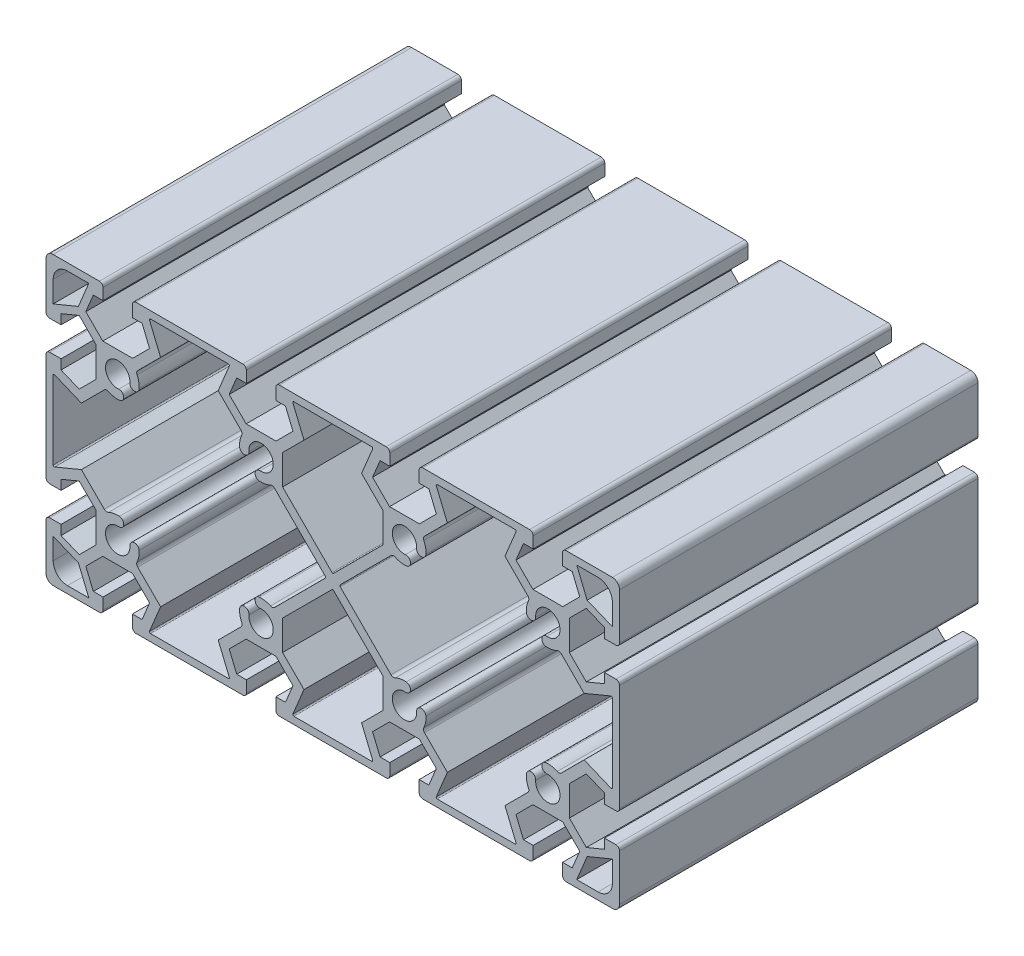
from build123d import *

# Parameters (mm, degrees)
EXTRUDE_1_DEPTH = 100


with BuildPart() as part:
    # 草图1 → 凸台-拉伸1 (new body)
    with BuildSketch(Plane.XY):
        with BuildLine():
            Line((-38.968782805, 40.151402525), (-53.868782805, 40.151402525))
            ThreePointArc((-53.868782805, 40.151402525), (-54.575889586, 39.858509306), (-54.868782805, 39.151402525))
            Line((-54.868782805, 39.151402525), (-54.868782805, 35.951402525))
            Line((-54.868782805, 35.951402525), (-52.168782805, 35.951402525))
            Line((-52.168782805, 35.951402525), (-50.071221467, 30.887441494))
            Line((-50.071221467, 30.887441494), (-54.807260436, 26.151402525))
            Line((-54.807260436, 26.151402525), (-63.130305174, 26.151402525))
            Line((-63.130305174, 26.151402525), (-67.866344143, 30.887441494))
            Line((-67.866344143, 30.887441494), (-65.768782805, 35.951402525))
            Line((-65.768782805, 35.951402525), (-63.068782805, 35.951402525))
            Line((-63.068782805, 35.951402525), (-63.068782805, 39.151402525))
            ThreePointArc((-63.068782805, 39.151402525), (-63.361676024, 39.858509306), (-64.068782805, 40.151402525))
            Line((-64.068782805, 40.151402525), (-76.968782805, 40.151402525))
            ThreePointArc((-76.968782805, 40.151402525), (-78.382996367, 39.565616087), (-78.968782805, 38.151402525))
            Line((-78.968782805, 38.151402525), (-78.968782805, 25.251402525))
            ThreePointArc((-78.968782805, 25.251402525), (-78.675889586, 24.544295743), (-77.968782805, 24.251402525))
            Line((-77.968782805, 24.251402525), (-74.768782805, 24.251402525))
            Line((-74.768782805, 24.251402525), (-74.768782805, 26.951402525))
            Line((-74.768782805, 26.951402525), (-69.704821774, 29.048963863))
            Line((-69.704821774, 29.048963863), (-64.968782805, 24.312924893))
            Line((-64.968782805, 24.312924893), (-64.968782805, 15.989880156))
            Line((-64.968782805, 15.989880156), (-69.704821774, 11.253841186))
            Line((-69.704821774, 11.253841186), (-74.768782805, 13.351402525))
            Line((-74.768782805, 13.351402525), (-74.768782805, 16.051402525))
            Line((-74.768782805, 16.051402525), (-77.968782805, 16.051402525))
            ThreePointArc((-77.968782805, 16.051402525), (-78.675889586, 15.758509306), (-78.968782805, 15.051402525))
            Line((-78.968782805, 15.051402525), (-78.968782805, 0.151402525))
            Line((-78.968782805, 0.151402525), (-78.968782805, -14.748597475))
            ThreePointArc((-78.968782805, -14.748597475), (-78.675889586, -15.455704257), (-77.968782805, -15.748597475))
            Line((-77.968782805, -15.748597475), (-74.768782805, -15.748597475))
            Line((-74.768782805, -15.748597475), (-74.768782805, -13.048597475))
            Line((-74.768782805, -13.048597475), (-69.704821774, -10.951036137))
            Line((-69.704821774, -10.951036137), (-64.968782805, -15.687075107))
            Line((-64.968782805, -15.687075107), (-64.968782805, -24.010119844))
            Line((-64.968782805, -24.010119844), (-69.704821774, -28.746158814))
            Line((-69.704821774, -28.746158814), (-74.768782805, -26.648597475))
            Line((-74.768782805, -26.648597475), (-74.768782805, -23.948597475))
            Line((-74.768782805, -23.948597475), (-77.968782805, -23.948597475))
            ThreePointArc((-77.968782805, -23.948597475), (-78.675889586, -24.241490694), (-78.968782805, -24.948597475))
            Line((-78.968782805, -24.948597475), (-78.968782805, -37.848597475))
            ThreePointArc((-78.968782805, -37.848597475), (-78.382996367, -39.262811038), (-76.968782805, -39.848597475))
            Line((-76.968782805, -39.848597475), (-64.068782805, -39.848597475))
            ThreePointArc((-64.068782805, -39.848597475), (-63.361676024, -39.555704257), (-63.068782805, -38.848597475))
            Line((-63.068782805, -38.848597475), (-63.068782805, -35.648597475))
            Line((-63.068782805, -35.648597475), (-65.768782805, -35.648597475))
            Line((-65.768782805, -35.648597475), (-67.866344143, -30.584636445))
            Line((-67.866344143, -30.584636445), (-63.130305174, -25.848597475))
            Line((-63.130305174, -25.848597475), (-54.807260436, -25.848597475))
            Line((-54.807260436, -25.848597475), (-50.071221467, -30.584636445))
            Line((-50.071221467, -30.584636445), (-52.168782805, -35.648597475))
            Line((-52.168782805, -35.648597475), (-54.868782805, -35.648597475))
            Line((-54.868782805, -35.648597475), (-54.868782805, -38.848597475))
            ThreePointArc((-54.868782805, -38.848597475), (-54.575889586, -39.555704257), (-53.868782805, -39.848597475))
            Line((-53.868782805, -39.848597475), (-38.968782805, -39.848597475))
            Line((-38.968782805, -39.848597475), (-24.068782805, -39.848597475))
            ThreePointArc((-24.068782805, -39.848597475), (-23.361676024, -39.555704257), (-23.068782805, -38.848597475))
            Line((-23.068782805, -38.848597475), (-23.068782805, -35.648597475))
            Line((-23.068782805, -35.648597475), (-25.768782805, -35.648597475))
            Line((-25.768782805, -35.648597475), (-27.866344143, -30.584636445))
            Line((-27.866344143, -30.584636445), (-23.130305174, -25.848597475))
            Line((-23.130305174, -25.848597475), (-14.807260436, -25.848597475))
            Line((-14.807260436, -25.848597475), (-10.071221467, -30.584636445))
            Line((-10.071221467, -30.584636445), (-12.168782805, -35.648597475))
            Line((-12.168782805, -35.648597475), (-14.868782805, -35.648597475))
            Line((-14.868782805, -35.648597475), (-14.868782805, -38.848597475))
            ThreePointArc((-14.868782805, -38.848597475), (-14.575889586, -39.555704257), (-13.868782805, -39.848597475))
            Line((-13.868782805, -39.848597475), (1.031217195, -39.848597475))
            Line((1.031217195, -39.848597475), (15.931217195, -39.848597475))
            ThreePointArc((15.931217195, -39.848597475), (16.638323976, -39.555704257), (16.931217195, -38.848597475))
            Line((16.931217195, -38.848597475), (16.931217195, -35.648597475))
            Line((16.931217195, -35.648597475), (14.231217195, -35.648597475))
            Line((14.231217195, -35.648597475), (12.133655857, -30.584636445))
            Line((12.133655857, -30.584636445), (16.869694826, -25.848597475))
            Line((16.869694826, -25.848597475), (25.192739564, -25.848597475))
            Line((25.192739564, -25.848597475), (29.928778533, -30.584636445))
            Line((29.928778533, -30.584636445), (27.831217195, -35.648597475))
            Line((27.831217195, -35.648597475), (25.131217195, -35.648597475))
            Line((25.131217195, -35.648597475), (25.131217195, -38.848597475))
            ThreePointArc((25.131217195, -38.848597475), (25.424110414, -39.555704257), (26.131217195, -39.848597475))
            Line((26.131217195, -39.848597475), (41.031217195, -39.848597475))
            Line((41.031217195, -39.848597475), (55.931217195, -39.848597475))
            ThreePointArc((55.931217195, -39.848597475), (56.638323976, -39.555704257), (56.931217195, -38.848597475))
            Line((56.931217195, -38.848597475), (56.931217195, -35.648597475))
            Line((56.931217195, -35.648597475), (54.231217195, -35.648597475))
            Line((54.231217195, -35.648597475), (52.133655857, -30.584636445))
            Line((52.133655857, -30.584636445), (56.869694826, -25.848597475))
            Line((56.869694826, -25.848597475), (65.192739564, -25.848597475))
            Line((65.192739564, -25.848597475), (69.928778533, -30.584636445))
            Line((69.928778533, -30.584636445), (67.831217195, -35.648597475))
            Line((67.831217195, -35.648597475), (65.131217195, -35.648597475))
            Line((65.131217195, -35.648597475), (65.131217195, -38.848597475))
            ThreePointArc((65.131217195, -38.848597475), (65.424110414, -39.555704257), (66.131217195, -39.848597475))
            Line((66.131217195, -39.848597475), (79.031217195, -39.848597475))
            ThreePointArc((79.031217195, -39.848597475), (80.445430757, -39.262811038), (81.031217195, -37.848597475))
            Line((81.031217195, -37.848597475), (81.031217195, -24.948597475))
            ThreePointArc((81.031217195, -24.948597475), (80.738323976, -24.241490694), (80.031217195, -23.948597475))
            Line((80.031217195, -23.948597475), (76.831217195, -23.948597475))
            Line((76.831217195, -23.948597475), (76.831217195, -26.648597475))
            Line((76.831217195, -26.648597475), (71.767256164, -28.746158814))
            Line((71.767256164, -28.746158814), (67.031217195, -24.010119844))
            Line((67.031217195, -24.010119844), (67.031217195, -15.687075107))
            Line((67.031217195, -15.687075107), (71.767256164, -10.951036137))
            Line((71.767256164, -10.951036137), (76.831217195, -13.048597475))
            Line((76.831217195, -13.048597475), (76.831217195, -15.748597475))
            Line((76.831217195, -15.748597475), (80.031217195, -15.748597475))
            ThreePointArc((80.031217195, -15.748597475), (80.738323976, -15.455704257), (81.031217195, -14.748597475))
            Line((81.031217195, -14.748597475), (81.031217195, 0.151402525))
            Line((81.031217195, 0.151402525), (81.031217195, 15.051402525))
            ThreePointArc((81.031217195, 15.051402525), (80.738323976, 15.758509306), (80.031217195, 16.051402525))
            Line((80.031217195, 16.051402525), (76.831217195, 16.051402525))
            Line((76.831217195, 16.051402525), (76.831217195, 13.351402525))
            Line((76.831217195, 13.351402525), (71.767256164, 11.253841186))
            Line((71.767256164, 11.253841186), (67.031217195, 15.989880156))
            Line((67.031217195, 15.989880156), (67.031217195, 24.312924893))
            Line((67.031217195, 24.312924893), (71.767256164, 29.048963863))
            Line((71.767256164, 29.048963863), (76.831217195, 26.951402525))
            Line((76.831217195, 26.951402525), (76.831217195, 24.251402525))
            Line((76.831217195, 24.251402525), (80.031217195, 24.251402525))
            ThreePointArc((80.031217195, 24.251402525), (80.738323976, 24.544295743), (81.031217195, 25.251402525))
            Line((81.031217195, 25.251402525), (81.031217195, 38.151402525))
            ThreePointArc((81.031217195, 38.151402525), (80.445430757, 39.565616087), (79.031217195, 40.151402525))
            Line((79.031217195, 40.151402525), (66.131217195, 40.151402525))
            ThreePointArc((66.131217195, 40.151402525), (65.424110414, 39.858509306), (65.131217195, 39.151402525))
            Line((65.131217195, 39.151402525), (65.131217195, 35.951402525))
            Line((65.131217195, 35.951402525), (67.831217195, 35.951402525))
            Line((67.831217195, 35.951402525), (69.928778533, 30.887441494))
            Line((69.928778533, 30.887441494), (65.192739564, 26.151402525))
            Line((65.192739564, 26.151402525), (56.869694826, 26.151402525))
            Line((56.869694826, 26.151402525), (52.133655857, 30.887441494))
            Line((52.133655857, 30.887441494), (54.231217195, 35.951402525))
            Line((54.231217195, 35.951402525), (56.931217195, 35.951402525))
            Line((56.931217195, 35.951402525), (56.931217195, 39.151402525))
            ThreePointArc((56.931217195, 39.151402525), (56.638323976, 39.858509306), (55.931217195, 40.151402525))
            Line((55.931217195, 40.151402525), (41.031217195, 40.151402525))
            Line((41.031217195, 40.151402525), (26.131217195, 40.151402525))
            ThreePointArc((26.131217195, 40.151402525), (25.424110414, 39.858509306), (25.131217195, 39.151402525))
            Line((25.131217195, 39.151402525), (25.131217195, 35.951402525))
            Line((25.131217195, 35.951402525), (27.831217195, 35.951402525))
            Line((27.831217195, 35.951402525), (29.928778533, 30.887441494))
            Line((29.928778533, 30.887441494), (25.192739564, 26.151402525))
            Line((25.192739564, 26.151402525), (16.869694826, 26.151402525))
            Line((16.869694826, 26.151402525), (12.133655857, 30.887441494))
            Line((12.133655857, 30.887441494), (14.231217195, 35.951402525))
            Line((14.231217195, 35.951402525), (16.931217195, 35.951402525))
            Line((16.931217195, 35.951402525), (16.931217195, 39.151402525))
            ThreePointArc((16.931217195, 39.151402525), (16.638323976, 39.858509306), (15.931217195, 40.151402525))
            Line((15.931217195, 40.151402525), (1.031217195, 40.151402525))
            Line((1.031217195, 40.151402525), (-13.868782805, 40.151402525))
            ThreePointArc((-13.868782805, 40.151402525), (-14.575889586, 39.858509306), (-14.868782805, 39.151402525))
            Line((-14.868782805, 39.151402525), (-14.868782805, 35.951402525))
            Line((-14.868782805, 35.951402525), (-12.168782805, 35.951402525))
            Line((-12.168782805, 35.951402525), (-10.071221467, 30.887441494))
            Line((-10.071221467, 30.887441494), (-14.807260436, 26.151402525))
            Line((-14.807260436, 26.151402525), (-23.130305174, 26.151402525))
            Line((-23.130305174, 26.151402525), (-27.866344143, 30.887441494))
            Line((-27.866344143, 30.887441494), (-25.768782805, 35.951402525))
            Line((-25.768782805, 35.951402525), (-23.068782805, 35.951402525))
            Line((-23.068782805, 35.951402525), (-23.068782805, 39.151402525))
            ThreePointArc((-23.068782805, 39.151402525), (-23.361676024, 39.858509306), (-24.068782805, 40.151402525))
            Line((-24.068782805, 40.151402525), (-38.968782805, 40.151402525))
        make_face()
        with BuildLine():
            Line((-67.022297368, 38.151402525), (-72.968782805, 38.151402525))
            ThreePointArc((-72.968782805, 38.151402525), (-75.79720993, 36.979829649), (-76.968782805, 34.151402525))
            Line((-76.968782805, 34.151402525), (-76.968782805, 28.204917088))
            Line((-76.968782805, 28.204917088), (-69.935555504, 31.118175223))
            Line((-69.935555504, 31.118175223), (-67.022297368, 38.151402525))
        make_face(mode=Mode.SUBTRACT)
        with BuildLine():
            Line((-76.968782805, 10.999470912), (-76.968782805, 0.151402525))
            Line((-76.968782805, 0.151402525), (-76.968782805, -10.696665863))
            ThreePointArc((-76.968782805, -10.696665863), (-76.835453875, -10.946106747), (-76.553977775, -10.973829723))
            Line((-76.553977775, -10.973829723), (-69.094775623, -7.884127027))
            Line((-69.094775623, -7.884127027), (-62.724477144, -14.254425505))
            ThreePointArc((-62.724477144, -14.254425505), (-62.183985002, -14.533340814), (-61.581857855, -14.447501403))
            ThreePointArc((-61.581857855, -14.447501403), (-60.069306273, -13.950390282), (-58.479261583, -13.86860007))
            ThreePointArc((-58.479261583, -13.86860007), (-57.28965841, -15.270329106), (-58.691387446, -16.459932279))
            ThreePointArc((-58.691387446, -16.459932279), (-61.372945861, -22.252760531), (-55.580117608, -19.571202116))
            ThreePointArc((-55.580117608, -19.571202116), (-54.390514435, -18.16947308), (-52.988785399, -19.359076253))
            ThreePointArc((-52.988785399, -19.359076253), (-53.070575612, -20.949120943), (-53.567686733, -22.461672525))
            ThreePointArc((-53.567686733, -22.461672525), (-53.653526144, -23.063799672), (-53.374610835, -23.604291815))
            Line((-53.374610835, -23.604291815), (-47.004312356, -29.974590293))
            Line((-47.004312356, -29.974590293), (-50.094015052, -37.433792446))
            ThreePointArc((-50.094015052, -37.433792446), (-50.066292076, -37.715268545), (-49.816851193, -37.848597475))
            Line((-49.816851193, -37.848597475), (-38.968782805, -37.848597475))
            Line((-38.968782805, -37.848597475), (-28.120714417, -37.848597475))
            ThreePointArc((-28.120714417, -37.848597475), (-27.871273534, -37.715268545), (-27.843550558, -37.433792446))
            Line((-27.843550558, -37.433792446), (-30.933253254, -29.974590293))
            Line((-30.933253254, -29.974590293), (-24.562954775, -23.604291815))
            ThreePointArc((-24.562954775, -23.604291815), (-24.284039466, -23.063799672), (-24.369878878, -22.461672525))
            ThreePointArc((-24.369878878, -22.461672525), (-24.866989999, -20.949120943), (-24.948780211, -19.359076253))
            ThreePointArc((-24.948780211, -19.359076253), (-23.547051175, -18.16947308), (-22.357448002, -19.571202116))
            ThreePointArc((-22.357448002, -19.571202116), (-16.564619749, -22.252760531), (-19.246178164, -16.459932279))
            ThreePointArc((-19.246178164, -16.459932279), (-20.647907201, -15.270329106), (-19.458304028, -13.86860007))
            ThreePointArc((-19.458304028, -13.86860007), (-17.868259338, -13.950390282), (-16.355707755, -14.447501403))
            ThreePointArc((-16.355707755, -14.447501403), (-15.753580609, -14.533340814), (-15.213088466, -14.254425505))
            Line((-15.213088466, -14.254425505), (-1.019392472, -0.060729511))
            ThreePointArc((-1.019392472, -0.060729511), (-0.931524505, 0.151402523), (-1.019392469, 0.363534558))
            Line((-1.019392469, 0.363534558), (-15.213088466, 14.557230554))
            ThreePointArc((-15.213088466, 14.557230554), (-15.753580609, 14.836145863), (-16.355707755, 14.750306452))
            ThreePointArc((-16.355707755, 14.750306452), (-17.868259338, 14.253195331), (-19.458304028, 14.171405119))
            ThreePointArc((-19.458304028, 14.171405119), (-20.647907201, 15.573134155), (-19.246178164, 16.762737328))
            ThreePointArc((-19.246178164, 16.762737328), (-16.564619749, 22.555565581), (-22.357448002, 19.874007165))
            ThreePointArc((-22.357448002, 19.874007165), (-23.547051175, 18.472278129), (-24.948780211, 19.661881302))
            ThreePointArc((-24.948780211, 19.661881302), (-24.866989999, 21.251925992), (-24.369878878, 22.764477574))
            ThreePointArc((-24.369878878, 22.764477574), (-24.284039466, 23.366604721), (-24.562954775, 23.907096864))
            Line((-24.562954775, 23.907096864), (-30.933253254, 30.277395342))
            Line((-30.933253254, 30.277395342), (-27.843550558, 37.736597495))
            ThreePointArc((-27.843550558, 37.736597495), (-27.871273534, 38.018073594), (-28.120714417, 38.151402525))
            Line((-28.120714417, 38.151402525), (-38.968782805, 38.151402525))
            Line((-38.968782805, 38.151402525), (-49.816851193, 38.151402525))
            ThreePointArc((-49.816851193, 38.151402525), (-50.066292076, 38.018073594), (-50.094015052, 37.736597495))
            Line((-50.094015052, 37.736597495), (-47.004312356, 30.277395342))
            Line((-47.004312356, 30.277395342), (-53.374610835, 23.907096864))
            ThreePointArc((-53.374610835, 23.907096864), (-53.653526144, 23.366604721), (-53.567686733, 22.764477574))
            ThreePointArc((-53.567686733, 22.764477574), (-53.070575612, 21.251925992), (-52.988785399, 19.661881302))
            ThreePointArc((-52.988785399, 19.661881302), (-54.390514435, 18.472278129), (-55.580117608, 19.874007165))
            ThreePointArc((-55.580117608, 19.874007165), (-61.372945861, 22.555565581), (-58.691387446, 16.762737328))
            ThreePointArc((-58.691387446, 16.762737328), (-57.28965841, 15.573134155), (-58.479261583, 14.171405119))
            ThreePointArc((-58.479261583, 14.171405119), (-60.069306273, 14.253195331), (-61.581857855, 14.750306452))
            ThreePointArc((-61.581857855, 14.750306452), (-62.183985002, 14.836145863), (-62.724477144, 14.557230554))
            Line((-62.724477144, 14.557230554), (-69.094775623, 8.186932076))
            Line((-69.094775623, 8.186932076), (-76.553977775, 11.276634772))
            ThreePointArc((-76.553977775, 11.276634772), (-76.835453875, 11.248911796), (-76.968782805, 10.999470912))
        make_face(mode=Mode.SUBTRACT)
        with BuildLine():
            Line((69.084731758, 38.151402525), (75.031217195, 38.151402525))
            ThreePointArc((75.031217195, 38.151402525), (77.85964432, 36.979829649), (79.031217195, 34.151402525))
            Line((79.031217195, 34.151402525), (79.031217195, 28.204917088))
            Line((79.031217195, 28.204917088), (71.997989894, 31.118175223))
            Line((71.997989894, 31.118175223), (69.084731758, 38.151402525))
        make_face(mode=Mode.SUBTRACT)
        with BuildLine():
            Line((79.031217195, 10.999470912), (79.031217195, 0.151402525))
            Line((79.031217195, 0.151402525), (79.031217195, -10.696665863))
            ThreePointArc((79.031217195, -10.696665863), (78.897888265, -10.946106747), (78.616412165, -10.973829723))
            Line((78.616412165, -10.973829723), (71.157210013, -7.884127027))
            Line((71.157210013, -7.884127027), (64.786911534, -14.254425505))
            ThreePointArc((64.786911534, -14.254425505), (64.246419391, -14.533340814), (63.644292245, -14.447501403))
            ThreePointArc((63.644292245, -14.447501403), (62.131740662, -13.950390282), (60.541695972, -13.86860007))
            ThreePointArc((60.541695972, -13.86860007), (59.352092799, -15.270329106), (60.753821836, -16.459932279))
            ThreePointArc((60.753821836, -16.459932279), (63.435380251, -22.252760531), (57.642551998, -19.571202116))
            ThreePointArc((57.642551998, -19.571202116), (56.452948825, -18.16947308), (55.051219789, -19.359076253))
            ThreePointArc((55.051219789, -19.359076253), (55.133010001, -20.949120943), (55.630121122, -22.461672525))
            ThreePointArc((55.630121122, -22.461672525), (55.715960534, -23.063799672), (55.437045225, -23.604291815))
            Line((55.437045225, -23.604291815), (49.066746746, -29.974590293))
            Line((49.066746746, -29.974590293), (52.156449442, -37.433792446))
            ThreePointArc((52.156449442, -37.433792446), (52.128726466, -37.715268545), (51.879285583, -37.848597475))
            Line((51.879285583, -37.848597475), (41.031217195, -37.848597475))
            Line((41.031217195, -37.848597475), (30.183148807, -37.848597475))
            ThreePointArc((30.183148807, -37.848597475), (29.933707924, -37.715268545), (29.905984948, -37.433792446))
            Line((29.905984948, -37.433792446), (32.995687644, -29.974590293))
            Line((32.995687644, -29.974590293), (26.625389165, -23.604291815))
            ThreePointArc((26.625389165, -23.604291815), (26.346473856, -23.063799672), (26.432313267, -22.461672525))
            ThreePointArc((26.432313267, -22.461672525), (26.929424388, -20.949120943), (27.011214601, -19.359076253))
            ThreePointArc((27.011214601, -19.359076253), (25.609485565, -18.16947308), (24.419882392, -19.571202116))
            ThreePointArc((24.419882392, -19.571202116), (18.627054139, -22.252760531), (21.308612554, -16.459932279))
            ThreePointArc((21.308612554, -16.459932279), (22.71034159, -15.270329106), (21.520738417, -13.86860007))
            ThreePointArc((21.520738417, -13.86860007), (19.930693727, -13.950390282), (18.418142145, -14.447501403))
            ThreePointArc((18.418142145, -14.447501403), (17.816014998, -14.533340814), (17.275522856, -14.254425505))
            Line((17.275522856, -14.254425505), (3.08182686, -0.06072951))
            ThreePointArc((3.08182686, -0.06072951), (2.993958895, 0.151402525), (3.08182686, 0.363534559))
            Line((3.08182686, 0.363534559), (17.275522856, 14.557230554))
            ThreePointArc((17.275522856, 14.557230554), (17.816014998, 14.836145863), (18.418142145, 14.750306452))
            ThreePointArc((18.418142145, 14.750306452), (19.930693727, 14.253195331), (21.520738417, 14.171405119))
            ThreePointArc((21.520738417, 14.171405119), (22.71034159, 15.573134155), (21.308612554, 16.762737328))
            ThreePointArc((21.308612554, 16.762737328), (18.627054139, 22.555565581), (24.419882392, 19.874007165))
            ThreePointArc((24.419882392, 19.874007165), (25.609485565, 18.472278129), (27.011214601, 19.661881302))
            ThreePointArc((27.011214601, 19.661881302), (26.929424388, 21.251925992), (26.432313267, 22.764477574))
            ThreePointArc((26.432313267, 22.764477574), (26.346473856, 23.366604721), (26.625389165, 23.907096864))
            Line((26.625389165, 23.907096864), (32.995687644, 30.277395342))
            Line((32.995687644, 30.277395342), (29.905984948, 37.736597495))
            ThreePointArc((29.905984948, 37.736597495), (29.933707924, 38.018073594), (30.183148807, 38.151402525))
            Line((30.183148807, 38.151402525), (41.031217195, 38.151402525))
            Line((41.031217195, 38.151402525), (51.879285583, 38.151402525))
            ThreePointArc((51.879285583, 38.151402525), (52.128726466, 38.018073594), (52.156449442, 37.736597495))
            Line((52.156449442, 37.736597495), (49.066746746, 30.277395342))
            Line((49.066746746, 30.277395342), (55.437045225, 23.907096864))
            ThreePointArc((55.437045225, 23.907096864), (55.715960534, 23.366604721), (55.630121122, 22.764477574))
            ThreePointArc((55.630121122, 22.764477574), (55.133010001, 21.251925992), (55.051219789, 19.661881302))
            ThreePointArc((55.051219789, 19.661881302), (56.452948825, 18.472278129), (57.642551998, 19.874007165))
            ThreePointArc((57.642551998, 19.874007165), (63.435380251, 22.555565581), (60.753821836, 16.762737328))
            ThreePointArc((60.753821836, 16.762737328), (59.352092799, 15.573134155), (60.541695972, 14.171405119))
            ThreePointArc((60.541695972, 14.171405119), (62.131740662, 14.253195331), (63.644292245, 14.750306452))
            ThreePointArc((63.644292245, 14.750306452), (64.246419391, 14.836145863), (64.786911534, 14.557230554))
            Line((64.786911534, 14.557230554), (71.157210013, 8.186932076))
            Line((71.157210013, 8.186932076), (78.616412165, 11.276634772))
            ThreePointArc((78.616412165, 11.276634772), (78.897888265, 11.248911796), (79.031217195, 10.999470912))
        make_face(mode=Mode.SUBTRACT)
        with BuildLine():
            Line((-67.022297368, -37.848597475), (-72.968782805, -37.848597475))
            ThreePointArc((-72.968782805, -37.848597475), (-75.79720993, -36.6770246), (-76.968782805, -33.848597475))
            Line((-76.968782805, -33.848597475), (-76.968782805, -27.902112039))
            Line((-76.968782805, -27.902112039), (-69.935555504, -30.815370174))
            Line((-69.935555504, -30.815370174), (-67.022297368, -37.848597475))
        make_face(mode=Mode.SUBTRACT)
        with BuildLine():
            Line((69.084731758, -37.848597475), (75.031217195, -37.848597475))
            ThreePointArc((75.031217195, -37.848597475), (77.85964432, -36.6770246), (79.031217195, -33.848597475))
            Line((79.031217195, -33.848597475), (79.031217195, -27.902112039))
            Line((79.031217195, -27.902112039), (71.997989894, -30.815370174))
            Line((71.997989894, -30.815370174), (69.084731758, -37.848597475))
        make_face(mode=Mode.SUBTRACT)
        with BuildLine():
            Line((-12.968782805, 24.312924893), (-12.968782805, 15.989880156))
            Line((-12.968782805, 15.989880156), (0.819085161, 2.20201219))
            ThreePointArc((0.819085161, 2.20201219), (1.031217195, 2.114144224), (1.243349229, 2.20201219))
            Line((1.243349229, 2.20201219), (15.031217195, 15.989880156))
            Line((15.031217195, 15.989880156), (15.031217195, 24.312924893))
            Line((15.031217195, 24.312924893), (9.066746746, 30.277395342))
            Line((9.066746746, 30.277395342), (12.156449442, 37.736597495))
            ThreePointArc((12.156449442, 37.736597495), (12.128726466, 38.018073594), (11.879285583, 38.151402525))
            Line((11.879285583, 38.151402525), (1.031217195, 38.151402525))
            Line((1.031217195, 38.151402525), (-9.816851193, 38.151402525))
            ThreePointArc((-9.816851193, 38.151402525), (-10.066292076, 38.018073594), (-10.094015052, 37.736597495))
            Line((-10.094015052, 37.736597495), (-7.004312356, 30.277395342))
            Line((-7.004312356, 30.277395342), (-12.968782805, 24.312924893))
        make_face(mode=Mode.SUBTRACT)
        with BuildLine():
            Line((-12.968782805, -24.010119844), (-12.968782805, -15.687075107))
            Line((-12.968782805, -15.687075107), (0.819085161, -1.899207141))
            ThreePointArc((0.819085161, -1.899207141), (1.031217195, -1.811339175), (1.243349229, -1.899207141))
            Line((1.243349229, -1.899207141), (15.031217195, -15.687075107))
            Line((15.031217195, -15.687075107), (15.031217195, -24.010119844))
            Line((15.031217195, -24.010119844), (9.066746746, -29.974590293))
            Line((9.066746746, -29.974590293), (12.156449442, -37.433792446))
            ThreePointArc((12.156449442, -37.433792446), (12.128726466, -37.715268545), (11.879285583, -37.848597475))
            Line((11.879285583, -37.848597475), (1.031217195, -37.848597475))
            Line((1.031217195, -37.848597475), (-9.816851193, -37.848597475))
            ThreePointArc((-9.816851193, -37.848597475), (-10.066292076, -37.715268545), (-10.094015053, -37.433792446))
            Line((-10.094015053, -37.433792446), (-7.004312356, -29.974590293))
            Line((-7.004312356, -29.974590293), (-12.968782805, -24.010119844))
        make_face(mode=Mode.SUBTRACT)
    extrude(amount=EXTRUDE_1_DEPTH)


solid = part.part
